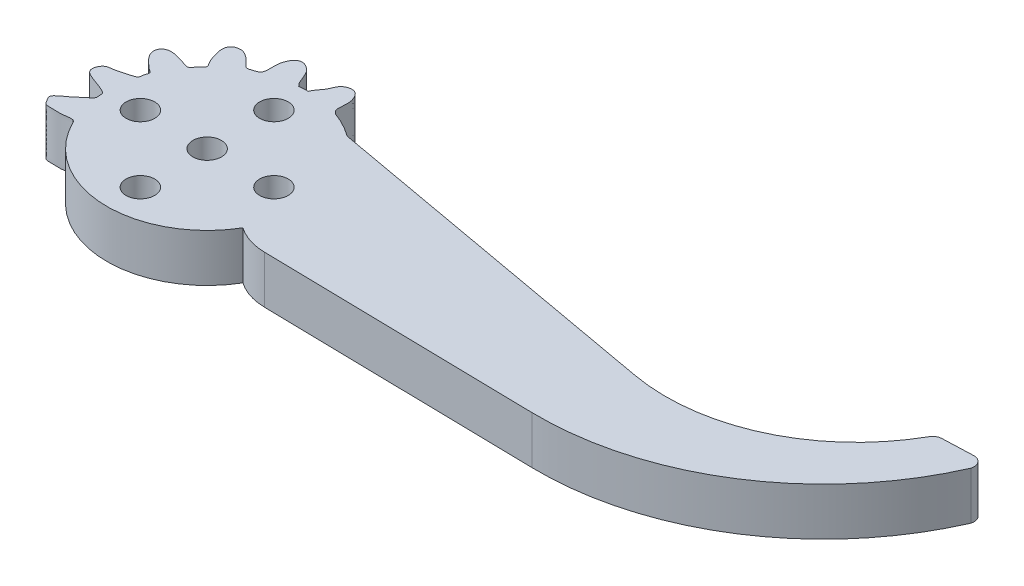
from build123d import *

# Parameters (mm, degrees)
EXTRUDE_1_DEPTH     = 5
SKETCH_2_R          = 1.5
CUT_EXTRUDE_1_DEPTH = 10


with BuildPart() as part:
    # 草图1 → 凸台-拉伸1 (new body)
    with BuildSketch(Plane(origin=(0, 0, 0), x_dir=(1, 0, 0), z_dir=(0, 1, 0))):
        with BuildLine():
            Line((-37.344631386, -5.807950968), (-37.248411234, -5.982727122))
            ThreePointArc((-37.248411234, -5.982727122), (-28.204573284, -11.73633278), (-18.822361929, -6.552792192))
            ThreePointArc((-18.822361929, -6.552792192), (-17.244766286, -7.336536325), (-15.507553828, -7.628350916))
            Line((-15.507553828, -7.628350916), (13.095059506, -8.174629585))
            ThreePointArc((13.095059506, -8.174629585), (29.839725685, -3.448118413), (41.144848497, 9.777536636))
            ThreePointArc((41.144848497, 9.777536636), (40.984858326, 10.682910927), (40.153252945, 11.07499759))
            Line((40.153252945, 11.07499759), (36.931315171, 10.955458653))
            ThreePointArc((36.931315171, 10.955458653), (36.448414047, 10.810326358), (36.097720698, 10.448012884))
            ThreePointArc((36.097720698, 10.448012884), (27.187916573, 2.183173181), (15.138321905, 0.602207281))
            Line((15.138321905, 0.602207281), (-21.117956687, 7.13390607))
            add(Edge.make_bspline(
                [(-21.117956687, 7.13390607), (-21.212438708, 7.147145532), (-21.306506603, 7.162309908), (-21.49538337, 7.196421735), (-21.589951037, 7.215369103), (-21.684261093, 7.235927839)],
                knots=[0, 0, 0, 0, 0.49706449, 0.49706449, 1, 1, 1, 1], degree=3, weights=[1, 1, 1, 1, 1, 1]))
            ThreePointArc((-21.684261093, 7.235927839), (-22.942337934, 8.025289306), (-24.299203626, 8.629246555))
            add(Edge.make_bspline(
                [(-24.299203626, 8.629246555), (-24.532798722, 8.924723672), (-24.768102501, 8.685486998), (-24.578542349, 10.190095573), (-24.654571202, 10.621705824), (-24.803745168, 11.123175885), (-25.053216231, 11.500198593), (-25.382740348, 11.741312615), (-25.805116059, 11.763790533), (-26.234027965, 11.628949186), (-26.602472691, 11.360783902), (-26.800767539, 10.992466414), (-27.032088728, 10.297448588), (-27.38256735, 9.995847546), (-27.702570577, 9.507372882), (-27.790875823, 9.258268525)],
                knots=[0, 0, 0, 0, 0, 0.167449509, 0.23958565, 0.313308301, 0.377037583, 0.439843636, 0.502444094, 0.564991993, 0.628373038, 0.693637199, 0.75910753, 0.826531761, 1, 1, 1, 1, 1], degree=4, weights=[1, 1, 1, 1, 1, 1, 1, 1, 1, 1, 1, 1, 1, 1, 1, 1]))
            ThreePointArc((-27.790875823, 9.258268525), (-28.268832567, 9.251439266), (-28.745983221, 9.222864058))
            add(Edge.make_bspline(
                [(-28.745983221, 9.222864058), (-29.066902207, 9.563243986), (-29.003830101, 9.495579417), (-29.514766582, 10.868497408), (-29.905161613, 11.223837825), (-30.346177399, 11.538345016), (-30.775308403, 11.647798666), (-31.15694413, 11.538709287), (-31.463842893, 11.213375665), (-31.705842412, 10.790755006), (-31.834670629, 10.277302759), (-31.866419694, 9.944996347), (-31.83604185, 8.770191318), (-31.986261554, 8.468967586), (-32.398385173, 8.329764062), (-33.012499398, 8.104959766), (-33.283321133, 8.126370455), (-33.879895168, 8.955709674), (-34.680669704, 9.454345775), (-35.06284292, 9.55525948), (-35.587974873, 9.478312866), (-35.964127285, 9.236934851), (-36.147105333, 8.859096563), (-36.146073043, 8.329493687), (-36.031334854, 7.805540112), (-35.622327566, 6.448258774), (-35.326900327, 6.495329828), (-35.351333042, 6.136137531)],
                knots=[0, 0, 0, 0, 0, 0.095392435, 0.134991598, 0.173690734, 0.207189476, 0.240204146, 0.273289811, 0.306894938, 0.34165608, 0.381579194, 0.419993738, 0.457685482, 0.49601353, 0.527899598, 0.564801156, 0.606644671, 0.647351641, 0.689606269, 0.727605881, 0.760625769, 0.793889264, 0.82747582, 0.866012031, 0.906297584, 1, 1, 1, 1, 1], degree=4, weights=[1, 1, 1, 1, 1, 1, 1, 1, 1, 1, 1, 1, 1, 1, 1, 1, 1, 1, 1, 1, 1, 1, 1, 1, 1, 1, 1, 1]))
            ThreePointArc((-35.351333042, 6.136137531), (-35.759710345, 5.698261663), (-36.142464276, 5.237819781))
            add(Edge.make_bspline(
                [(-36.142464276, 5.237819781), (-36.316981842, 5.08700098), (-36.364843159, 5.164195713), (-37.277553315, 5.361322432), (-37.942352515, 5.632502616), (-38.633084665, 5.719911328), (-38.916484297, 5.653640329), (-39.225256107, 5.520939787), (-39.426320972, 5.322329921), (-39.547878388, 5.065868766), (-39.568398866, 4.735036382), (-39.524871996, 4.458902174), (-39.16786209, 3.873039426), (-38.740480537, 3.466567721), (-38.254674568, 3.007325653), (-37.89044397, 2.777372811), (-37.656773339, 2.648376094), (-37.969468798, 2.074801064), (-37.897206508, 1.785036627), (-38.16497334, 1.405765757), (-38.769354556, 1.455206174), (-39.306904188, 1.096918841), (-40.327751852, 0.992639828)],
                knots=[0, 0, 0, 0, 0, 0.102550458, 0.155534355, 0.209164784, 0.256715345, 0.297927651, 0.334519967, 0.370936874, 0.407252906, 0.448167315, 0.495157377, 0.547294774, 0.600812707, 0.64848443, 0.693866455, 0.734504866, 0.772381689, 0.811633204, 0.850281548, 1, 1, 1, 1, 1], degree=4, weights=[1, 1, 1, 1, 1, 1, 1, 1, 1, 1, 1, 1, 1, 1, 1, 1, 1, 1, 1, 1, 1, 1, 1]))
            add(Edge.make_bspline(
                [(-40.327751852, 0.992639828), (-40.49027737, 0.999571003), (-40.713154313, 0.91888235), (-40.954457401, 0.693661162), (-41.131350194, 0.334630013), (-41.190329001, 0.056784013), (-41.165475288, -0.202186055), (-41.036582783, -0.421471855), (-40.816165219, -0.600297662), (-40.485452339, -0.766914084), (-40.174203742, -0.898416494), (-39.25769897, -1.22048507), (-38.599409521, -1.479244035), (-38.503826201, -1.571250392), (-38.367074379, -1.759763033)],
                knots=[0, 0, 0, 0, 0, 0.159645777, 0.225638641, 0.291020065, 0.354611709, 0.417161288, 0.480844731, 0.547969405, 0.628060899, 0.718716062, 0.808353036, 1, 1, 1, 1, 1], degree=4, weights=[1, 1, 1, 1, 1, 1, 1, 1, 1, 1, 1, 1, 1, 1, 1]))
            ThreePointArc((-38.367074379, -1.759763033), (-38.347731001, -2.0623835), (-38.319656978, -2.364319193))
            add(Edge.make_bspline(
                [(-38.458232897, -2.611814716), (-38.363269625, -2.502883946), (-38.319656978, -2.364319193)],
                knots=[6.268589243, 6.268589243, 6.268589243, 6.667480636, 6.667480636, 6.667480636], degree=2, weights=[1, 0.98017655, 1]))
            Line((-38.458232897, -2.611814716), (-39.843574761, -3.775330159))
            add(Edge.make_bspline(
                [(-39.843574761, -3.775330159), (-40.139361501, -3.958461335), (-40.682847629, -4.400349644), (-40.828769837, -4.549848056), (-40.898925147, -4.775101532), (-40.871489252, -4.91522108), (-40.811114459, -5.028783036), (-40.571272458, -5.405781269), (-40.423210722, -5.641288577), (-40.145787809, -5.743817026), (-39.223236405, -5.725906874), (-38.753478222, -5.796957019), (-37.770070415, -5.55854552), (-37.471743463, -5.662437325), (-37.408096689, -5.726699879), (-37.344631386, -5.807950968)],
                knots=[0, 0, 0, 0, 0, 0.194272729, 0.24161924, 0.28232288, 0.331387847, 0.386783464, 0.447394339, 0.523862686, 0.607321354, 0.701771427, 0.796543812, 0.874384733, 1, 1, 1, 1, 1], degree=4, weights=[1, 1, 1, 1, 1, 1, 1, 1, 1, 1, 1, 1, 1, 1, 1, 1]))
        make_face()
    extrude(amount=EXTRUDE_1_DEPTH)

    # 草图2 → 切除-拉伸1 (cut)
    with BuildSketch(Plane(origin=(0, 5, 0), x_dir=(1, 0, 0), z_dir=(0, 1, 0))):
        with Locations(Location((-27.879879662, -1.241354229, 0), (0, 0, 270))):
            Circle(SKETCH_2_R)
        with Locations(Location((-27.879879662, 5.758645771, 0), (0, 0, 270))):
            Circle(SKETCH_2_R)
        with Locations(Location((-20.879879662, -1.241354229, 0), (0, 0, 270))):
            Circle(SKETCH_2_R)
        with Locations(Location((-27.879879662, -8.241354229, 0), (0, 0, 270))):
            Circle(SKETCH_2_R)
        with Locations(Location((-34.879879662, -1.241354229, 0), (0, 0, 270))):
            Circle(SKETCH_2_R)
    extrude(amount=-CUT_EXTRUDE_1_DEPTH, mode=Mode.SUBTRACT)


solid = part.part
